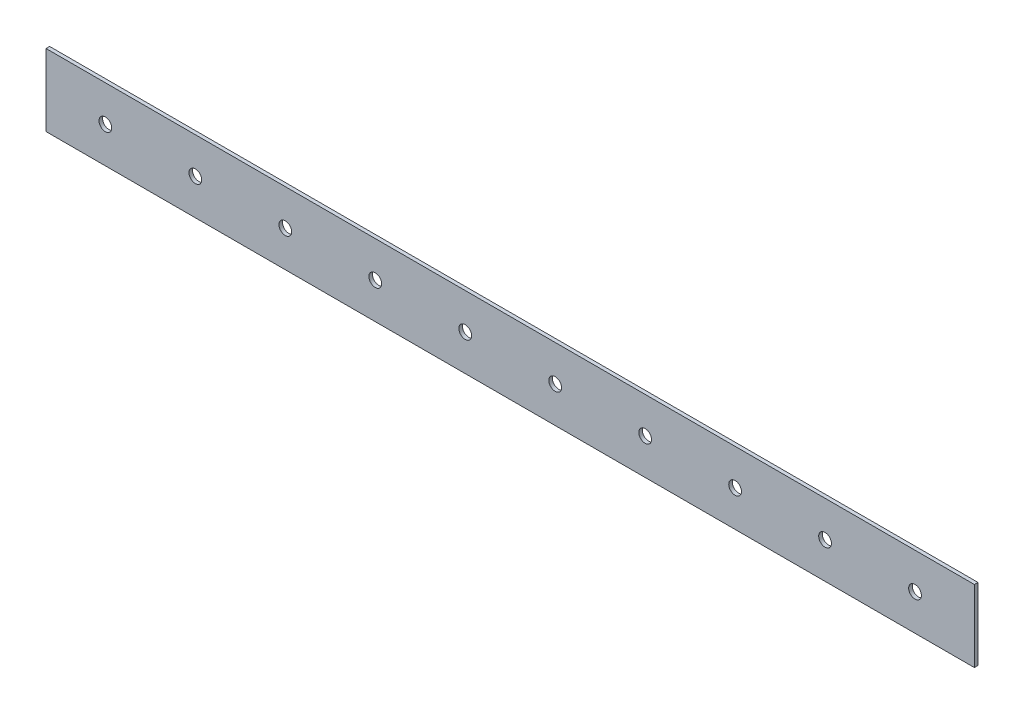
from build123d import *

# Parameters (mm, degrees)
SKETCH_1_W      = 258
SKETCH_1_H      = 20
SKETCH_1_R      = 1.771140708
EXTRUDE_1_DEPTH = 1


with BuildPart() as part:
    # 스케치1 → 보스-돌출1 (new body)
    with BuildSketch(Plane.XY):
        Rectangle(SKETCH_1_W, SKETCH_1_H)
        with Locations((-12.5, 0)):
            Circle(SKETCH_1_R, mode=Mode.SUBTRACT)
        with Locations((-37.5, 0)):
            Circle(SKETCH_1_R, mode=Mode.SUBTRACT)
        with Locations((-62.5, 0)):
            Circle(SKETCH_1_R, mode=Mode.SUBTRACT)
        with Locations((-87.5, 0)):
            Circle(SKETCH_1_R, mode=Mode.SUBTRACT)
        with Locations((-112.5, 0)):
            Circle(SKETCH_1_R, mode=Mode.SUBTRACT)
        with Locations(Location((112.5, 0, 0), (0, 0, 180))):
            Circle(SKETCH_1_R, mode=Mode.SUBTRACT)
        with Locations(Location((87.5, 0, 0), (0, 0, 180))):
            Circle(SKETCH_1_R, mode=Mode.SUBTRACT)
        with Locations(Location((62.5, 0, 0), (0, 0, 180))):
            Circle(SKETCH_1_R, mode=Mode.SUBTRACT)
        with Locations(Location((37.5, 0, 0), (0, 0, 180))):
            Circle(SKETCH_1_R, mode=Mode.SUBTRACT)
        with Locations(Location((12.5, 0, 0), (0, 0, 180))):
            Circle(SKETCH_1_R, mode=Mode.SUBTRACT)
    extrude(amount=EXTRUDE_1_DEPTH)


solid = part.part
